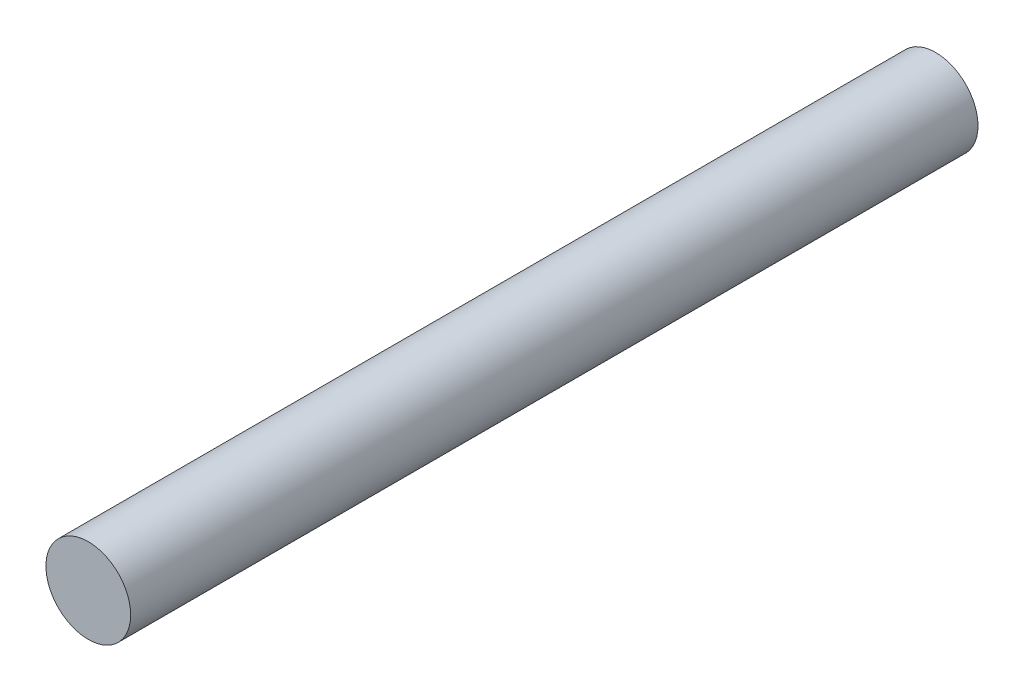
from build123d import *

# Parameters (mm, degrees)
BOSS_EXTRUDE1_DEPTH      = 10
BOSS_EXTRUDE1_DEPTH_BACK = 10
SKETCH1_R                = 1


with BuildPart() as part:
    # Sketch1 → Boss-Extrude1 (new, two sides: drawn at the far end of the back side and taken through both)
    with BuildSketch(Plane.XY.offset(-BOSS_EXTRUDE1_DEPTH_BACK)):
        with Locations((-941.662974387, 304.387338025)):
            Circle(SKETCH1_R)
    extrude(amount=BOSS_EXTRUDE1_DEPTH + BOSS_EXTRUDE1_DEPTH_BACK)


solid = part.part
